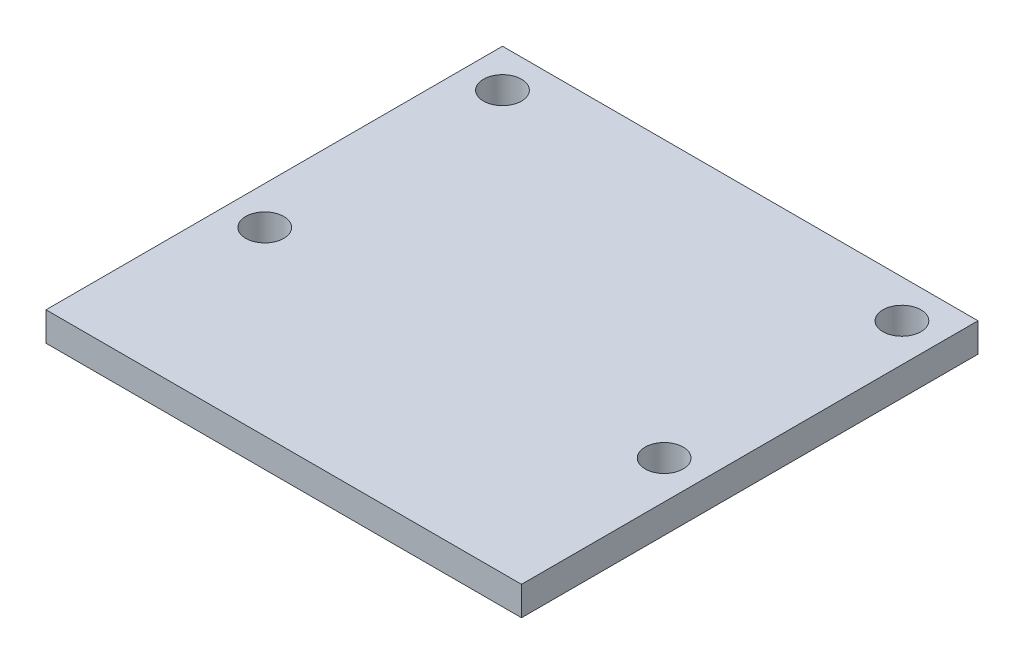
from build123d import *

# Parameters (mm, degrees)
SKETCH2_W           = 25
SKETCH2_H           = 24
SKETCH2_R           = 1
BOSS_EXTRUDE1_DEPTH = 1.524


with BuildPart() as part:
    # Sketch2 → Boss-Extrude1 (new body)
    with BuildSketch(Plane(origin=(0, 0, 0), x_dir=(1, 0, 0), z_dir=(0, 1, 0))):
        with Locations((12.5, 12)):
            Rectangle(SKETCH2_W, SKETCH2_H)
        with Locations(Location((2, 22, 0), (0, 0, 90))):
            Circle(SKETCH2_R, mode=Mode.SUBTRACT)
        with Locations(Location((23, 22, 0), (0, 0, 90))):
            Circle(SKETCH2_R, mode=Mode.SUBTRACT)
        with Locations(Location((23, 9.5, 0), (0, 0, 90))):
            Circle(SKETCH2_R, mode=Mode.SUBTRACT)
        with Locations(Location((2, 9.5, 0), (0, 0, 90))):
            Circle(SKETCH2_R, mode=Mode.SUBTRACT)
    extrude(amount=BOSS_EXTRUDE1_DEPTH)


solid = part.part
